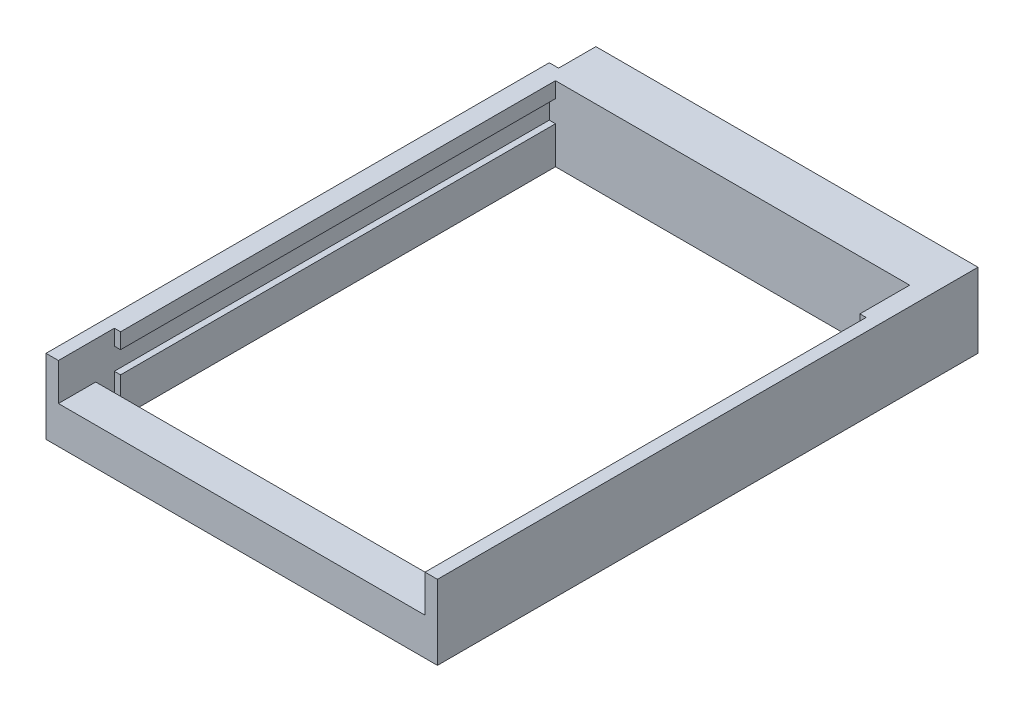
from build123d import *

# Parameters (mm, degrees)
EXTRUDE_1_DEPTH      = 3
EXTRUDE_1_DEPTH_BACK = 3
SKETCH_2_W           = 0.5
SKETCH_2_H           = 1.25
SKETCH_2_H_2         = 3
EXTRUDE_2_DEPTH      = 35
SKETCH_3_W           = 6
SKETCH_3_H           = 3
CUT_EXTRUDE_1_DEPTH  = 1.5
CUT_EXTRUDE_2_REACH  = 31.123
SKETCH_4_W           = 0.75
SKETCH_4_H           = 3
SKETCH_2_4_W         = 0.5
SKETCH_2_4_H         = 1.25
EXTRUDE_3_DEPTH      = 4
EXTRUDE_4_REACH      = 40.773
SKETCH_5_W           = 3
SKETCH_5_H           = 3


with BuildPart() as part:
    # 草图1 → 凸台-拉伸1 (new, two sides: drawn at the far end of the back side and taken through both)
    with BuildSketch(Plane(origin=(0, 0, 0), x_dir=(1, 0, 0), z_dir=(0, 1, 0)).offset(-EXTRUDE_1_DEPTH_BACK)):
        Polygon((-14.75, -19.75), (-14.75, 19.75), (14.75, 19.75), (14.75, -19.75), (15.75, -19.75), (15.75, 23.75), (-15.75, 23.75), (-15.75, -19.75), align=None)
    extrude(amount=EXTRUDE_1_DEPTH + EXTRUDE_1_DEPTH_BACK)

    # 草图2 → 凸台-拉伸2 (add)
    with BuildSketch(Plane.XY.offset(-19.75)):
        with Locations((-14.5, 2.375)):
            Rectangle(SKETCH_2_W, SKETCH_2_H)
        with Locations((-14.5, -1.5)):
            Rectangle(SKETCH_2_W, SKETCH_2_H_2)
        with Locations((14.5, -1.5)):
            Rectangle(SKETCH_2_W, SKETCH_2_H_2)
    extrude(amount=EXTRUDE_2_DEPTH)

    # 草图3 → 切除-拉伸1 (cut)
    with BuildSketch(Plane(origin=(0, 0, -23.75), x_dir=(-1, 0, 0), z_dir=(0, 0, -1))):
        with Locations((-9.25, -1.5)):
            Rectangle(SKETCH_3_W, SKETCH_3_H)
        with Locations((9.25, -1.5)):
            Rectangle(SKETCH_3_W, SKETCH_3_H)
    extrude(amount=-CUT_EXTRUDE_1_DEPTH, mode=Mode.SUBTRACT)

    # 草图4 → 切除-拉伸2 (cut, up to next)
    with BuildSketch(Plane(origin=(0, 3, 0), x_dir=(1, 0, 0), z_dir=(0, 1, 0)), mode=Mode.PRIVATE) as cut_extrude_2_sk1:
        with Locations((-15.375, 22.25)):
            Rectangle(SKETCH_4_W, SKETCH_4_H)
    cut_extrude_2_tool1 = extrude(cut_extrude_2_sk1.sketch, amount=-CUT_EXTRUDE_2_REACH, mode=Mode.PRIVATE) & part.part
    add(cut_extrude_2_tool1.solids().sort_by_distance((-15.375, 3, -22.25))[0], mode=Mode.SUBTRACT)

    # 草图2<4> → 凸台-拉伸3 (add)
    with BuildSketch(Plane.XY.offset(-19.75)):
        with Locations((14.5, 2.375)):
            Rectangle(SKETCH_2_4_W, SKETCH_2_4_H)
    extrude(amount=EXTRUDE_3_DEPTH)

    # 草图5 → 凸台-拉伸4 (add, up to next)
    with BuildSketch(Plane(origin=(-14.75, 0, 0), x_dir=(0, 0, -1), z_dir=(1, 0, 0)), mode=Mode.PRIVATE) as extrude_4_sk1:
        with Locations((-18.25, -1.5)):
            Rectangle(SKETCH_5_W, SKETCH_5_H)
    extrude_4_tool1 = extrude(extrude_4_sk1.sketch, amount=EXTRUDE_4_REACH, mode=Mode.PRIVATE) - part.part
    add(extrude_4_tool1.solids().sort_by_distance((-14.75, -1.5, 18.25))[0])


solid = part.part
